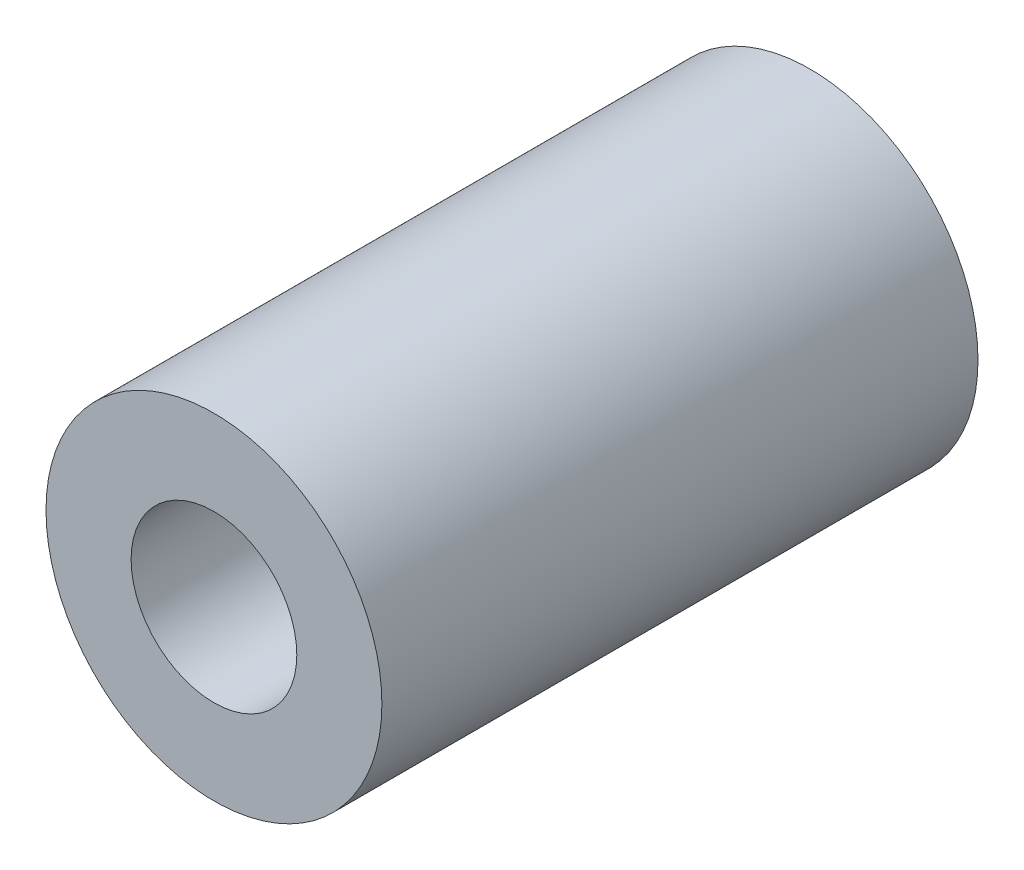
from build123d import *

# Parameters (mm, degrees)
SKETCH1_R           = 7.5
BOSS_EXTRUDE1_DEPTH = 26.62
SKETCH4_R           = 3.7
CUT_EXTRUDE1_DEPTH  = 26.62


with BuildPart() as part:
    # Sketch1 → Boss-Extrude1 (new body)
    with BuildSketch(Plane.XY):
        with Locations(Location((0, 0, 0), (0, 0, 180))):
            Circle(SKETCH1_R)
    extrude(amount=BOSS_EXTRUDE1_DEPTH)

    # Sketch4 → Cut-Extrude1 (cut)
    with BuildSketch(Plane(origin=(0, 0, 0), x_dir=(-1, 0, 0), z_dir=(0, 0, -1))):
        Circle(SKETCH4_R)
    extrude(amount=-CUT_EXTRUDE1_DEPTH, mode=Mode.SUBTRACT)


solid = part.part
